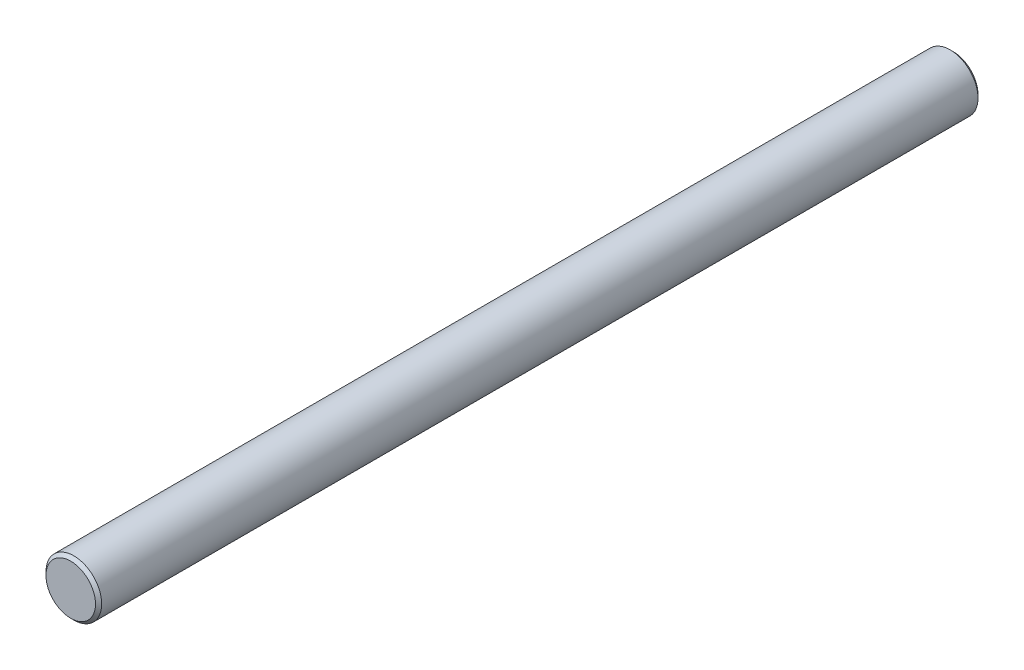
from build123d import *

# Parameters (mm, degrees)
SKETCH1_R           = 2.286
BOSS_EXTRUDE1_DEPTH = 72.39
CHAMFER1_SIZE       = 0.254


with BuildPart() as part:
    # Sketch1 → Boss-Extrude1 (new body)
    with BuildSketch(Plane.XY):
        Circle(SKETCH1_R)
    extrude(amount=BOSS_EXTRUDE1_DEPTH)

    # Chamfer1
    chamfer1_edges = [part.edges().sort_by_distance(p)[0] for p in [
        (-2.286, 0, 0),
        (-2.286, 0, 72.39),
    ]]
    chamfer(chamfer1_edges, length=CHAMFER1_SIZE)


solid = part.part
